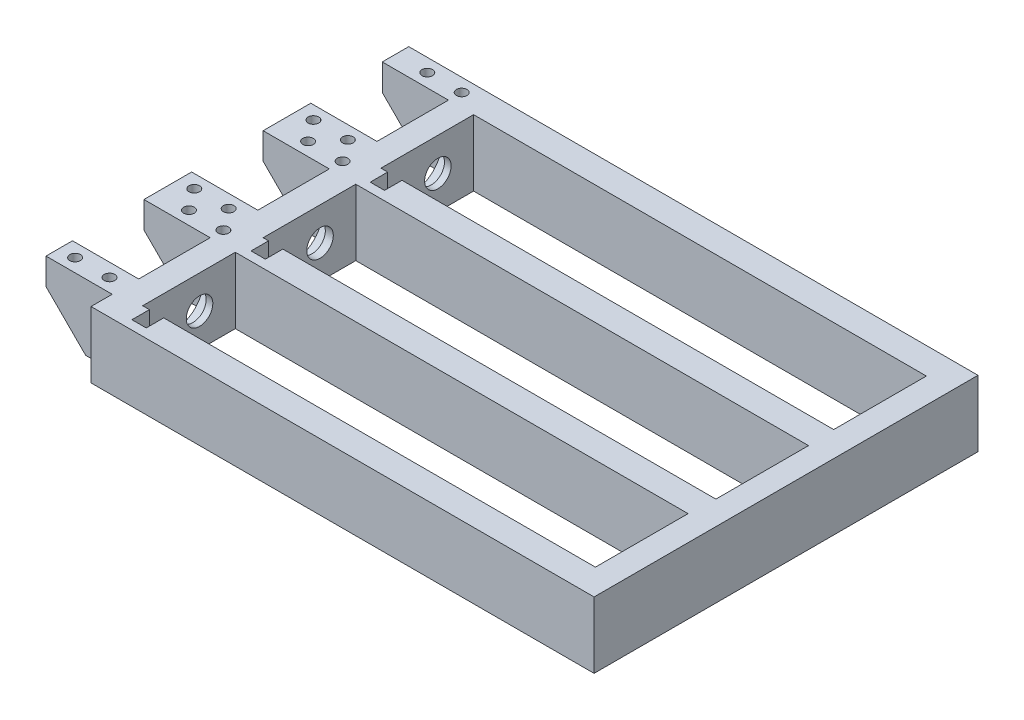
from build123d import *

# Parameters (mm, degrees)
SZKIC1_W                    = 190
SZKIC1_H                    = 145
DODANIE_WYCI_GNI_CIE1_DEPTH = 25
SZKIC2_W                    = 171
SZKIC2_H                    = 35
WYTNIJ_WYCI_GNI_CIE1_DEPTH  = 50
SZKIC3_R                    = 11
WYTNIJ_WYCI_GNI_CIE2_DEPTH  = 7
SZKIC4_R                    = 11
WYTNIJ_WYCI_GNI_CIE3_DEPTH  = 7
SZKIC5_R                    = 5
WYTNIJ_WYCI_GNI_CIE4_DEPTH  = 7
SZKIC7_W                    = 25
SZKIC7_H                    = 10
DODANIE_WYCI_GNI_CIE2_DEPTH = 25
SZKIC8_R                    = 2
WYTNIJ_WYCI_GNI_CIE5_DEPTH  = 12
WYTNIJ_WYCI_GNI_CIE6_DEPTH  = 40
SZYK_LINIOWY1_COUNT         = 3
SZYK_LINIOWY1_PITCH         = 45
SFAZOWANIE1_SIZE            = 15


with BuildPart() as part:
    # Szkic1 → Dodanie-wyciągnięcie1 (new body)
    with BuildSketch(Plane(origin=(0, 0, 0), x_dir=(1, 0, 0), z_dir=(0, 1, 0))):
        Rectangle(SZKIC1_W, SZKIC1_H)
    extrude(amount=DODANIE_WYCI_GNI_CIE1_DEPTH)

    # Szkic2 → Wytnij-wyciągnięcie1 (cut)
    with BuildSketch(Plane(origin=(0, 25, 0), x_dir=(1, 0, 0), z_dir=(0, 1, 0))):
        with Locations((0.5, 0)):
            Rectangle(SZKIC2_W, SZKIC2_H)
        with Locations((0, -45)):
            Rectangle(SZKIC2_W, SZKIC2_H)
        with Locations((0, 45)):
            Rectangle(SZKIC2_W, SZKIC2_H)
    extrude(amount=-WYTNIJ_WYCI_GNI_CIE1_DEPTH, mode=Mode.SUBTRACT)

    # Szkic3 → Wytnij-wyciągnięcie2 (cut)
    with BuildSketch(Plane.ZY.offset(-85.5)):
        with Locations((41, 12.5)):
            Circle(SZKIC3_R)
    wytnij_wyci_gni_cie2 = extrude(amount=-WYTNIJ_WYCI_GNI_CIE2_DEPTH, mode=Mode.SUBTRACT)

    # Szkic4 → Wytnij-wyciągnięcie3 (cut)
    with BuildSketch(Plane.ZY.offset(95)):
        with Locations((41, 12.5)):
            Circle(SZKIC4_R)
    wytnij_wyci_gni_cie3 = extrude(amount=-WYTNIJ_WYCI_GNI_CIE3_DEPTH, mode=Mode.SUBTRACT)

    # Szkic5 → Wytnij-wyciągnięcie4 (cut)
    with BuildSketch(Plane.ZY.offset(88)):
        with Locations((41, 12.5)):
            Circle(SZKIC5_R)
    wytnij_wyci_gni_cie4 = extrude(amount=-WYTNIJ_WYCI_GNI_CIE4_DEPTH, mode=Mode.SUBTRACT)

    # Szkic7 → Dodanie-wyciągnięcie2 (add)
    with BuildSketch(Plane(origin=(0, 25, 0), x_dir=(1, 0, 0), z_dir=(0, 1, 0))):
        with Locations((-107.5, -22.5)):
            Rectangle(SZKIC7_W, SZKIC7_H)
        with Locations((-107.5, -59.5)):
            Rectangle(SZKIC7_W, SZKIC7_H)
    dodanie_wyci_gni_cie2 = extrude(amount=-DODANIE_WYCI_GNI_CIE2_DEPTH)

    # Szkic8 → Wytnij-wyciągnięcie5 (cut)
    with BuildSketch(Plane(origin=(0, 25, 0), x_dir=(1, 0, 0), z_dir=(0, 1, 0))):
        with Locations(Location((-114, -59.5, 0), (0, 0, 270))):
            Circle(SZKIC8_R)
        with Locations(Location((-101, -59.5, 0), (0, 0, 270))):
            Circle(SZKIC8_R)
        with Locations(Location((-108, -22.5, 0), (0, 0, 270))):
            Circle(SZKIC8_R)
        with Locations(Location((-95, -22.5, 0), (0, 0, 270))):
            Circle(SZKIC8_R)
    wytnij_wyci_gni_cie5 = extrude(amount=-WYTNIJ_WYCI_GNI_CIE5_DEPTH, mode=Mode.SUBTRACT)

    # Szkic10 → Wytnij-wyciągnięcie6 (cut)
    with BuildSketch(Plane(origin=(0, 25, 0), x_dir=(1, 0, 0), z_dir=(0, 1, 0))):
        with BuildLine():
            Line((-77.55, -69.1), (-77.55, -62.5))
            Line((-77.55, -62.5), (-79.425, -62.5))
            Line((-79.425, -62.5), (-79.425, -64.360545416))
            ThreePointArc((-79.425, -64.360545416), (-80.25, -68.6), (-81.075, -64.360545416))
            Line((-81.075, -64.360545416), (-81.075, -62.5))
            Line((-81.075, -62.5), (-82.95, -62.5))
            Line((-82.95, -62.5), (-82.95, -69.1))
            Line((-82.95, -69.1), (-77.55, -69.1))
        make_face()
        with BuildLine():
            Line((-79.425, -64.360545416), (-79.425, -62.5))
            Line((-79.425, -62.5), (-81.075, -62.5))
            Line((-81.075, -62.5), (-81.075, -64.360545416))
            ThreePointArc((-81.075, -64.360545416), (-80.25, -68.6), (-79.425, -64.360545416))
        make_face()
    wytnij_wyci_gni_cie6 = extrude(amount=-WYTNIJ_WYCI_GNI_CIE6_DEPTH, mode=Mode.SUBTRACT)

    # Szyk liniowy1: Wytnij-wyciągnięcie2, Wytnij-wyciągnięcie3, Wytnij-wyciągnięcie4, Dodanie-wyciągnięcie2, Wytnij-wyciągnięcie5, Wytnij-wyciągnięcie6 ×3
    with Locations(*[(0, 0, -i * SZYK_LINIOWY1_PITCH) for i in range(1, SZYK_LINIOWY1_COUNT)]):
        add(wytnij_wyci_gni_cie2, mode=Mode.SUBTRACT)
        add(wytnij_wyci_gni_cie3, mode=Mode.SUBTRACT)
        add(wytnij_wyci_gni_cie4, mode=Mode.SUBTRACT)
        add(dodanie_wyci_gni_cie2)
        add(wytnij_wyci_gni_cie5, mode=Mode.SUBTRACT)
        add(wytnij_wyci_gni_cie6, mode=Mode.SUBTRACT)

    # Sfazowanie1
    sfazowanie1_edges = [part.edges().sort_by_distance(p)[0] for p in [
        (-120, 0, 59.5),
        (-120, 0, -26.5),
        (-120, 0, -67.5),
        (-120, 0, 18.5),
    ]]
    chamfer(sfazowanie1_edges, length=SFAZOWANIE1_SIZE)


solid = part.part
